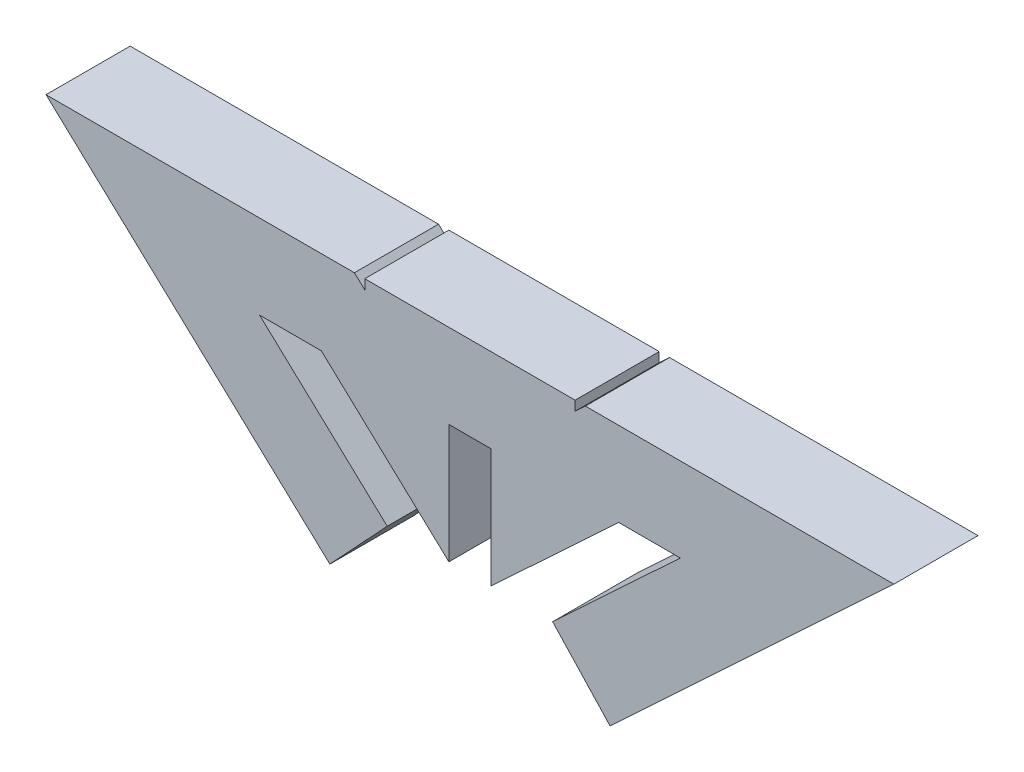
from build123d import *

# Parameters (mm, degrees)
EXTRUDE_1_DEPTH = 10


with BuildPart() as part:
    # ｽｹｯﾁ1 → 押し出し-薄板1 (new body)
    with BuildSketch(Plane.XY):
        Polygon((-9.831802189, -14.143108085), (-25, 0), (-17.668197811, 0), (-2.5, -14.143108085), (-2.5, 0), (2.5, 0), (2.5, -14.143108085), (17.668197811, 0), (25, 0), (9.831802189, -14.143108085), (16.651407889, -21.456997481), (50.388402435, 10), (13.72939149, 10), (12.5, 8.853692645), (12.5, 10), (-12.5, 10), (-12.5, 8.853692645), (-13.72939149, 10), (-50.388402435, 10), (-16.651407889, -21.456997481), align=None)
    extrude(amount=EXTRUDE_1_DEPTH)


solid = part.part
